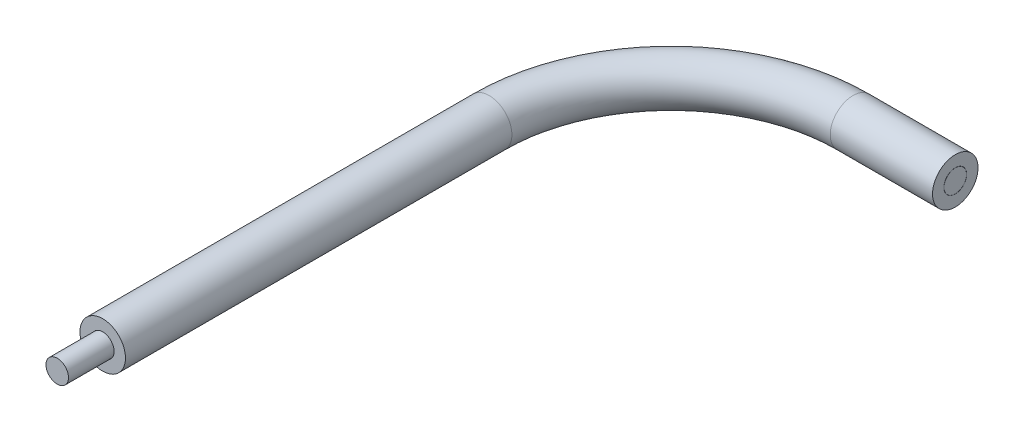
from build123d import *

# Parameters (mm, degrees)
SKETCH_2_R   = 1
SKETCH_2_R_2 = 0.5
SKETCH_4_R   = 0.495


with BuildPart() as part:
    # 扫描1: sweep along a path in 草图1
    with BuildLine(Plane(origin=(0, 0, 0), x_dir=(1, 0, 0), z_dir=(0, 1, 0))) as sweep_1_path:
        Line((0, 0), (0, 17))
        ThreePointArc((0, 17), (2.343145751, 22.656854249), (8, 25))
        Line((8, 25), (12.5, 25))
    # 草图2 → 扫描1 (sweep)
    with BuildSketch(Plane.XY):
        Circle(SKETCH_2_R)
        Circle(SKETCH_2_R_2, mode=Mode.SUBTRACT)
    sweep(path=sweep_1_path.line)


with BuildPart() as body_2:
    # 扫描2: sweep along a path in 草图3
    with BuildLine(Plane(origin=(0, 0, 0), x_dir=(1, 0, 0), z_dir=(0, 1, 0))) as sweep_2_path:
        Line((12.5, 25), (8, 25))
        ThreePointArc((8, 25), (2.343145751, 22.656854249), (0, 17))
        Line((0, 17), (0, 0))
        Line((0, 0), (0, -2))
    # 草图4 → 扫描2 (sweep)
    with BuildSketch(Plane.XY):
        Circle(SKETCH_4_R)
    sweep(path=sweep_2_path.line)


solid = Compound([part.part, body_2.part])
